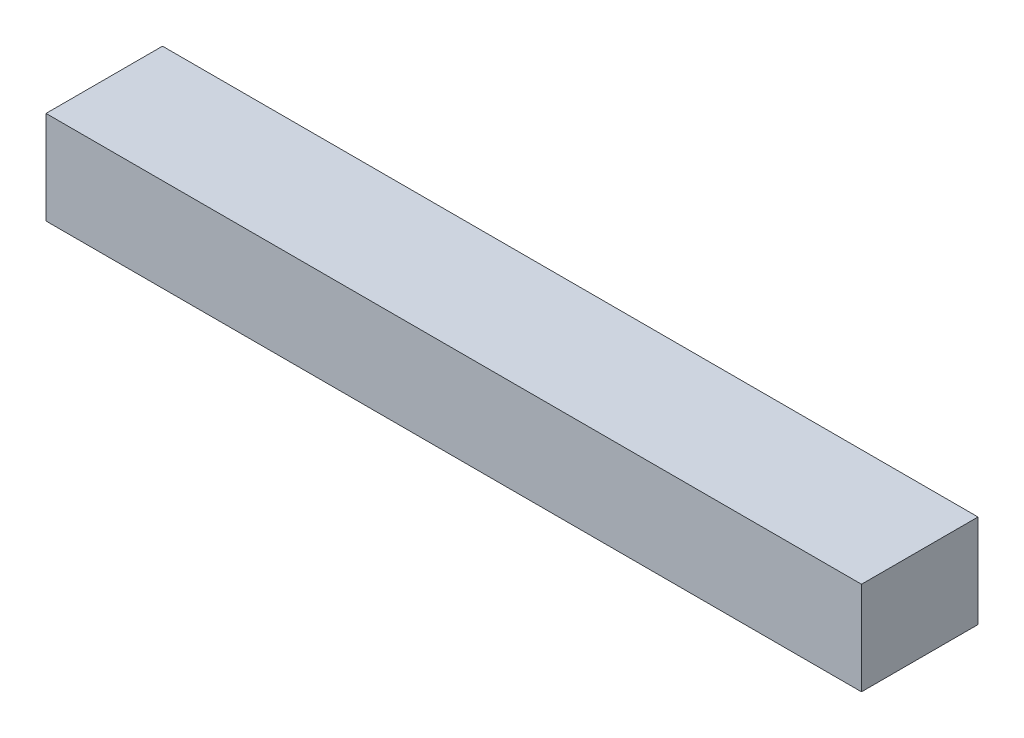
from build123d import *

# Parameters (mm, degrees)
SKETCH1_W           = 10
SKETCH1_H           = 8
BOSS_EXTRUDE1_DEPTH = 70


with BuildPart() as part:
    # Sketch1 → Boss-Extrude1 (new body)
    with BuildSketch(Plane(origin=(0, 0, 0), x_dir=(0, 0, -1), z_dir=(1, 0, 0))):
        with Locations((5, 4)):
            Rectangle(SKETCH1_W, SKETCH1_H)
    extrude(amount=BOSS_EXTRUDE1_DEPTH)


solid = part.part
